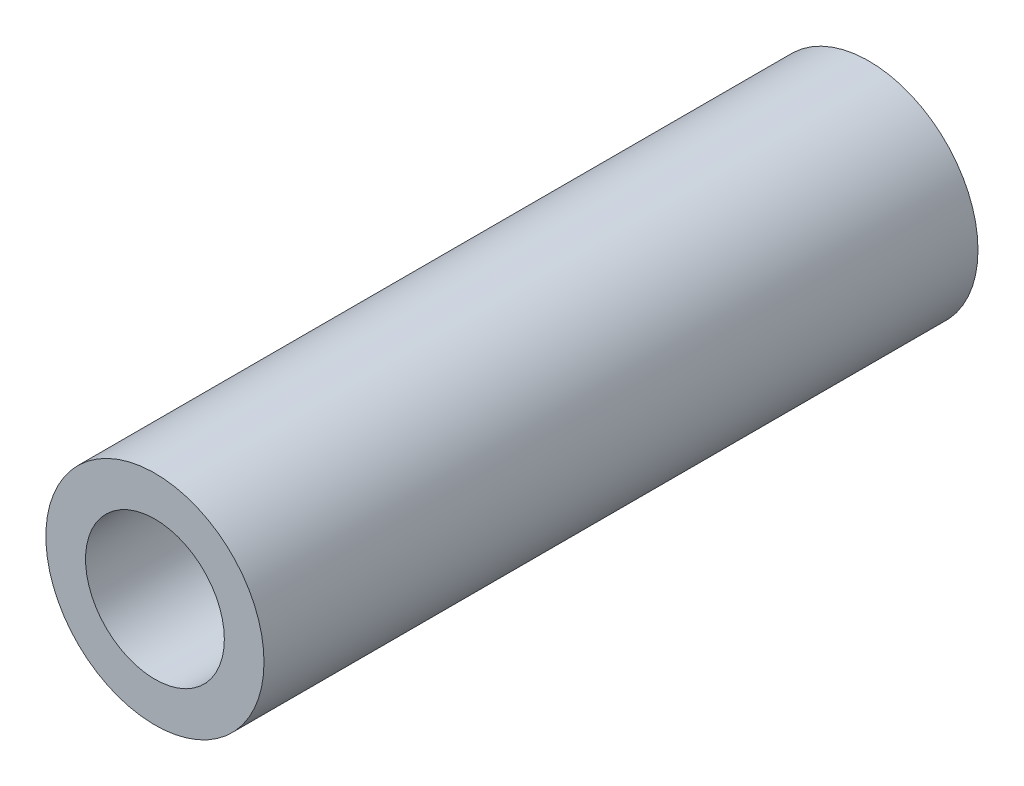
from build123d import *

# Parameters (mm, degrees)
SKETCH_1_R      = 2.75
SKETCH_1_R_2    = 1.75
EXTRUDE_1_DEPTH = 18


with BuildPart() as part:
    # 草图1 → 凸台-拉伸1 (new body)
    with BuildSketch(Plane.XY):
        Circle(SKETCH_1_R)
        Circle(SKETCH_1_R_2, mode=Mode.SUBTRACT)
    extrude(amount=EXTRUDE_1_DEPTH)


solid = part.part
